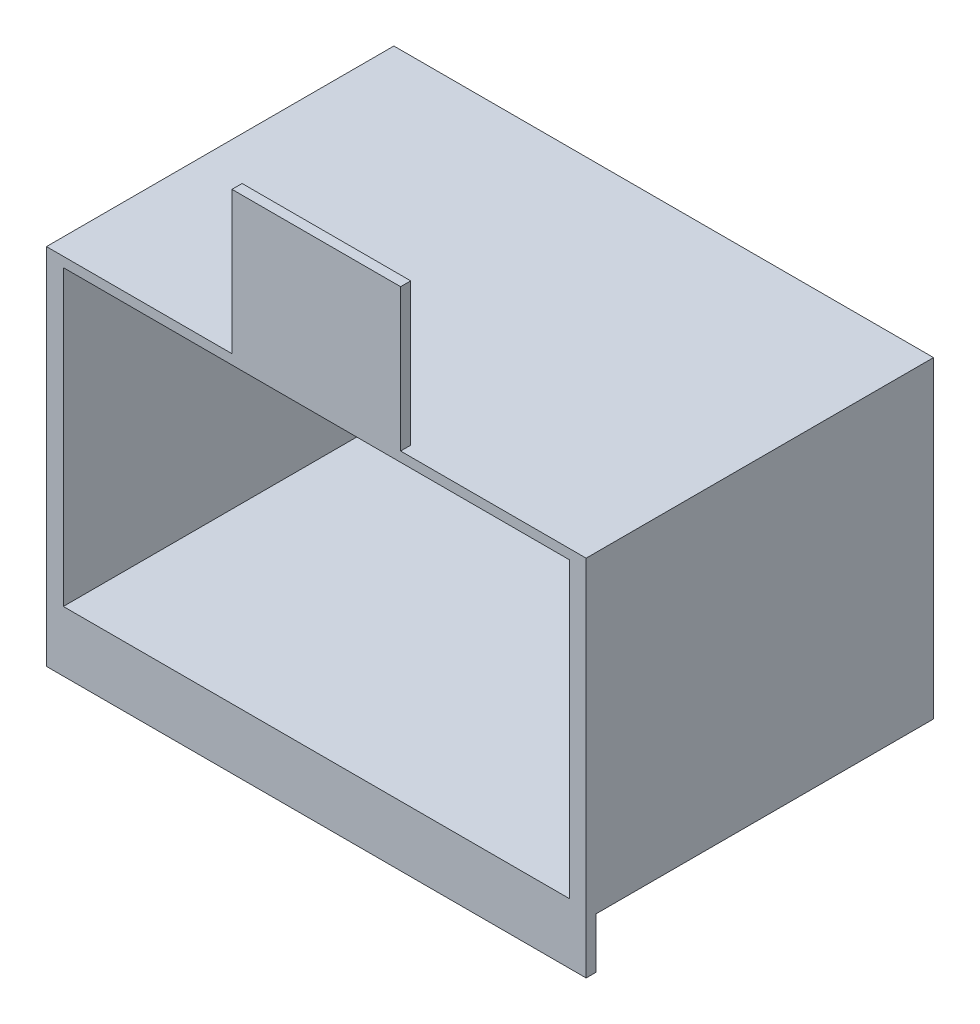
from build123d import *

# Parameters (mm, degrees)
SKETCH_1_W          = 160
SKETCH_1_H          = 150
EXTRUDE_1_DEPTH     = 3
SKETCH_2_W          = 160
SKETCH_2_H          = 92.8
SKETCH_2_W_2        = 150
SKETCH_2_H_2        = 87
EXTRUDE_2_DEPTH     = 100
SKETCH_4_W          = 55
SKETCH_4_H          = 42.2
CUT_EXTRUDE_2_DEPTH = 3
SKETCH_5_W          = 160
SKETCH_5_H          = 15
SKETCH_5_W_2        = 50
SKETCH_5_H_2        = 42.2
EXTRUDE_3_DEPTH     = 3
SKETCH_5_2_W        = 160
SKETCH_5_2_H        = 15
SKETCH_5_2_W_2      = 50
SKETCH_5_2_H_2      = 42.2
CUT_EXTRUDE_3_DEPTH = 149.408220797


with BuildPart() as part:
    # ｽｹｯﾁ1 → ﾎﾞｽ - 押し出し1 (new body)
    with BuildSketch(Plane.XY):
        Rectangle(SKETCH_1_W, SKETCH_1_H)
    extrude(amount=EXTRUDE_1_DEPTH)

    # ｽｹｯﾁ2 → ﾎﾞｽ - 押し出し2 (add)
    with BuildSketch(Plane.XY.offset(3)):
        with Locations((0, -13.6)):
            Rectangle(SKETCH_2_W, SKETCH_2_H)
        with Locations((0, -13.6)):
            Rectangle(SKETCH_2_W_2, SKETCH_2_H_2, mode=Mode.SUBTRACT)
    extrude(amount=EXTRUDE_2_DEPTH)

    # ｽｹｯﾁ4 → ｶｯﾄ - 押し出し2 (cut)
    with BuildSketch(Plane.XY.offset(3)):
        with Locations((-52.5, 53.9)):
            Rectangle(SKETCH_4_W, SKETCH_4_H)
        with Locations((52.5, 53.9)):
            Rectangle(SKETCH_4_W, SKETCH_4_H)
    extrude(amount=-CUT_EXTRUDE_2_DEPTH, mode=Mode.SUBTRACT)

    # ｽｹｯﾁ5 → ﾎﾞｽ - 押し出し3 (add)
    with BuildSketch(Plane(origin=(0, 0, 100), x_dir=(-1, 0, 0), z_dir=(0, 0, -1))):
        with Locations((0, -67.5)):
            Rectangle(SKETCH_5_W, SKETCH_5_H)
        with Locations((0, 53.9)):
            Rectangle(SKETCH_5_W_2, SKETCH_5_H_2)
    extrude(amount=-EXTRUDE_3_DEPTH)

    # ｽｹｯﾁ5<2> → ｶｯﾄ - 押し出し3 (cut, through all)
    with BuildSketch(Plane(origin=(0, 0, 100), x_dir=(-1, 0, 0), z_dir=(0, 0, -1))):
        with Locations((0, -67.5)):
            Rectangle(SKETCH_5_2_W, SKETCH_5_2_H)
        with Locations((0, 53.9)):
            Rectangle(SKETCH_5_2_W_2, SKETCH_5_2_H_2)
    extrude(amount=CUT_EXTRUDE_3_DEPTH, mode=Mode.SUBTRACT)


solid = part.part
